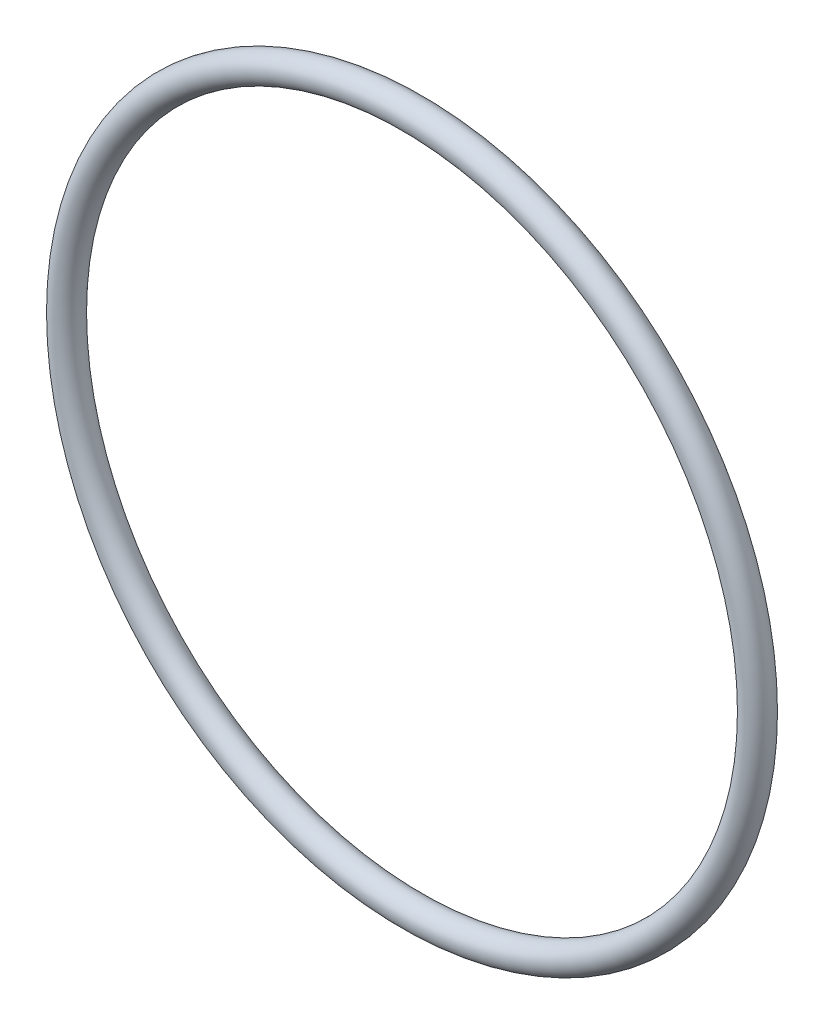
from build123d import *

# Parameters (mm, degrees)
SKETCH2_R = 1.7653


with BuildPart() as part:
    # Sketch2 → Revolve1 (revolve)
    with BuildSketch(Plane(origin=(0, 0, 0), x_dir=(0, 0, -1), z_dir=(1, 0, 0)), mode=Mode.PRIVATE) as revolve1_sk:
        with Locations((0, 43.0403)):
            Circle(SKETCH2_R)
    revolve(revolve1_sk.sketch.rotate(Axis((0, 0, 5.972582188), (0, 0, -1)), 90), axis=Axis((0, 0, 5.972582188), (0, 0, -1)))


solid = part.part
